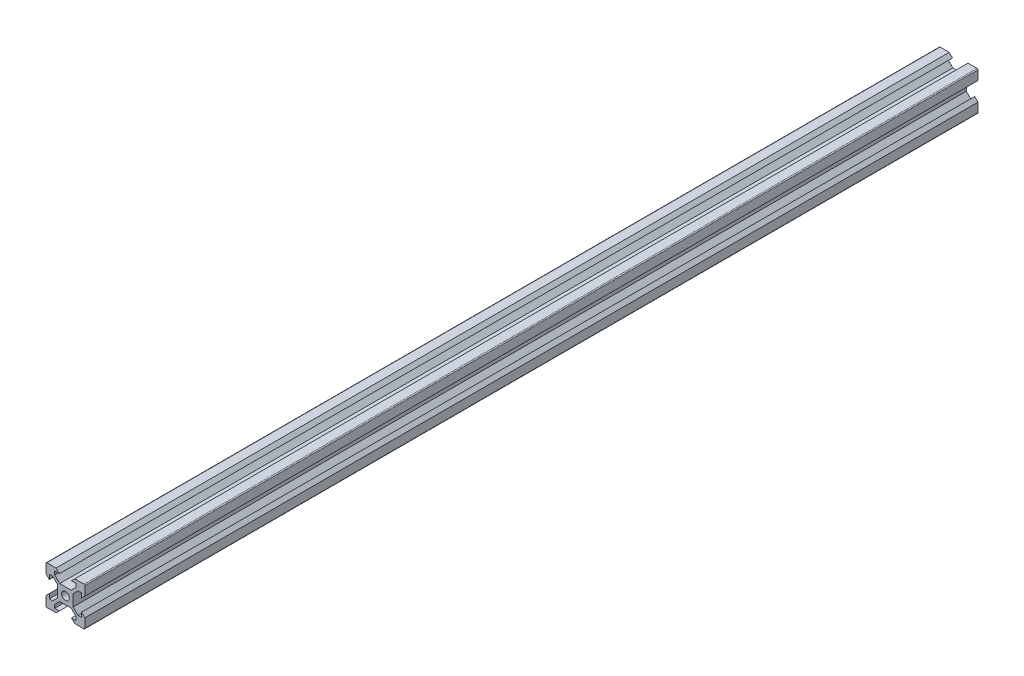
from build123d import *

# Parameters (mm, degrees)
CROQUIS1_R              = 2
SALIENTE_EXTRUIR2_DEPTH = 230


with BuildPart() as part:
    # Croquis1 → Saliente-Extruir2 (new, symmetric)
    with BuildSketch(Plane.XY):
        with BuildLine():
            Line((-4.825, 10), (-3.125, 8.3))
            Line((-3.125, 8.3), (-5.5, 8.3))
            Line((-5.5, 8.3), (-5.5, 6.560660172))
            Line((-5.5, 6.560660172), (-2.939339828, 4))
            Line((-2.939339828, 4), (2.939339828, 4))
            Line((2.939339828, 4), (5.5, 6.560660172))
            Line((5.5, 6.560660172), (5.5, 8.3))
            Line((5.5, 8.3), (3.125, 8.3))
            Line((3.125, 8.3), (4.825, 10))
            Line((4.825, 10), (9.5, 10))
            ThreePointArc((9.5, 10), (9.853553391, 9.853553391), (10, 9.5))
            Line((10, 9.5), (10, 4.825))
            Line((10, 4.825), (8.3, 3.125))
            Line((8.3, 3.125), (8.3, 5.5))
            Line((8.3, 5.5), (6.560660172, 5.5))
            Line((6.560660172, 5.5), (4, 2.939339828))
            Line((4, 2.939339828), (4, -2.939339828))
            Line((4, -2.939339828), (6.560660172, -5.5))
            Line((6.560660172, -5.5), (8.3, -5.5))
            Line((8.3, -5.5), (8.3, -3.125))
            Line((8.3, -3.125), (10, -4.825))
            Line((10, -4.825), (10, -9.5))
            ThreePointArc((10, -9.5), (9.853553391, -9.853553391), (9.5, -10))
            Line((9.5, -10), (4.825, -10))
            Line((4.825, -10), (3.125, -8.3))
            Line((3.125, -8.3), (5.5, -8.3))
            Line((5.5, -8.3), (5.5, -6.560660172))
            Line((5.5, -6.560660172), (2.939339828, -4))
            Line((2.939339828, -4), (-2.939339828, -4))
            Line((-2.939339828, -4), (-5.5, -6.560660172))
            Line((-5.5, -6.560660172), (-5.5, -8.3))
            Line((-5.5, -8.3), (-3.125, -8.3))
            Line((-3.125, -8.3), (-4.825, -10))
            Line((-4.825, -10), (-9.5, -10))
            ThreePointArc((-9.5, -10), (-9.853553391, -9.853553391), (-10, -9.5))
            Line((-10, -9.5), (-10, -4.825))
            Line((-10, -4.825), (-8.3, -3.125))
            Line((-8.3, -3.125), (-8.3, -5.5))
            Line((-8.3, -5.5), (-6.560660172, -5.5))
            Line((-6.560660172, -5.5), (-4, -2.939339828))
            Line((-4, -2.939339828), (-4, 2.939339828))
            Line((-4, 2.939339828), (-6.560660172, 5.5))
            Line((-6.560660172, 5.5), (-8.3, 5.5))
            Line((-8.3, 5.5), (-8.3, 3.125))
            Line((-8.3, 3.125), (-10, 4.825))
            Line((-10, 4.825), (-10, 9.5))
            ThreePointArc((-10, 9.5), (-9.853553391, 9.853553391), (-9.5, 10))
            Line((-9.5, 10), (-4.825, 10))
        make_face()
        Circle(CROQUIS1_R, mode=Mode.SUBTRACT)
    extrude(amount=SALIENTE_EXTRUIR2_DEPTH, both=True)


solid = part.part
